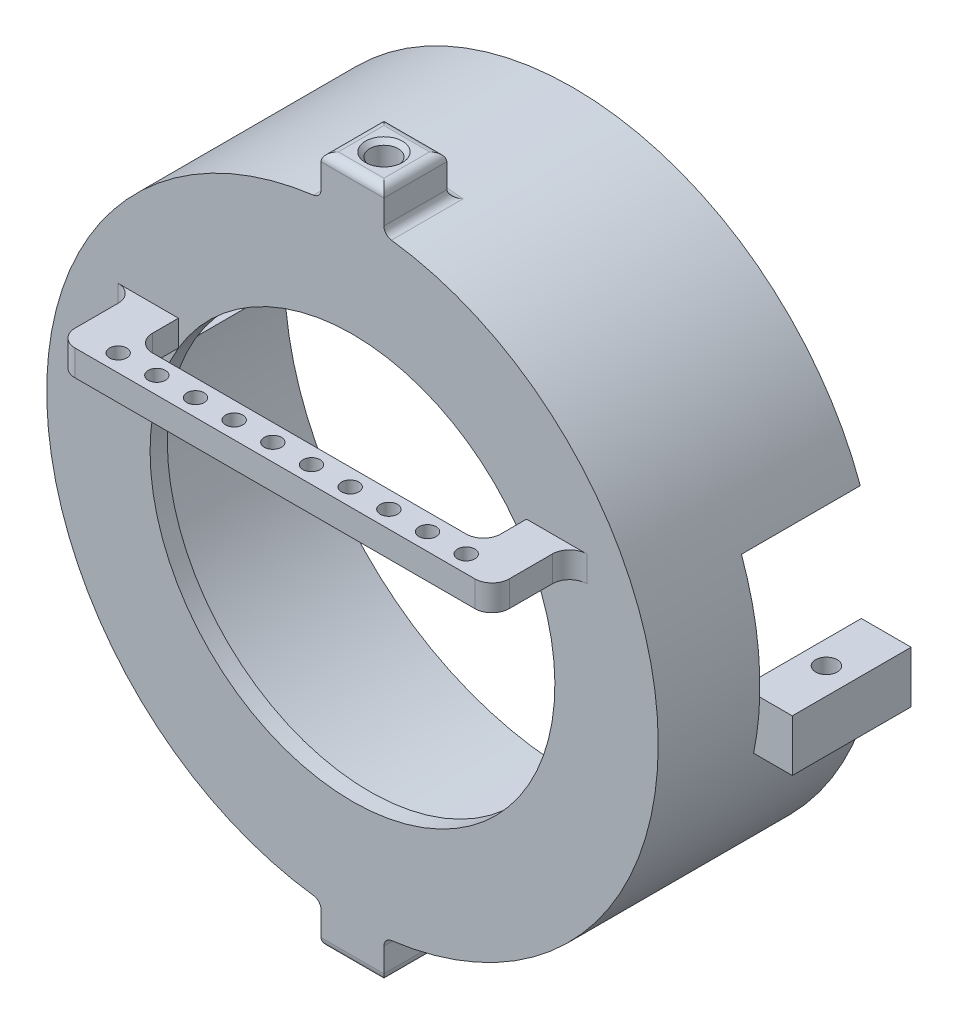
from build123d import *

# Parameters (mm, degrees)
BOSS_EXTRUDE1_REACH      = 96.735
BOSS_EXTRUDE1_END_RADIUS = 35.5
BOSS_EXTRUDE1_START      = 39.26
SKETCH6_W                = 6
SKETCH6_H                = 13.8
CUT_EXTRUDE2_DEPTH       = 58.953063767
CUT_EXTRUDE2_DEPTH_BACK  = 58.953063767
SKETCH6_3_W              = 2.3
SKETCH6_3_H              = 13.8
SKETCH11_R               = 1.25
CUT_EXTRUDE5_DEPTH       = 59.664555739
BOSS_EXTRUDE4_REACH      = 99.953
BOSS_EXTRUDE4_END_RADIUS = 35.5
BOSS_EXTRUDE4_START      = 40
SKETCH12_W               = 7.302
SKETCH12_H               = 7.302
BOSS_EXTRUDE5_REACH      = 102.814
BOSS_EXTRUDE5_END_RADIUS = 35.5
BOSS_EXTRUDE5_START      = -40
SKETCH12_5_W             = 7.302
SKETCH12_5_H             = 7.302
CUT_EXTRUDE6_DEPTH       = 61.81371227
CUT_EXTRUDE6_DEPTH_BACK  = 61.81371227
FILLET2_R                = 1
CHAMFER2_SIZE            = 0.5
SKETCH9_W                = 3
SKETCH9_H                = 13.8
CUT_REVOLVE1_ANGLE       = 20
SKETCH13_R               = 1
BOSS_EXTRUDE6_DEPTH      = 3
FILLET3_R                = 2


with BuildPart() as part:
    # Sketch3 → Revolve1 (revolve)
    with BuildSketch(Plane.YZ, mode=Mode.PRIVATE) as revolve1_sk:
        Polygon((23.5, 0), (33.5, 0), (33.5, -23.6), (35.5, -23.6), (35.5, 2), (23.5, 2), align=None)
    revolve(revolve1_sk.sketch.rotate(Axis((0, 0, 0), (0, 0, 1)), 90), axis=Axis((0, 0, 0), (0, 0, 1)))

    # Boss-Extrude1: up to this cylinder (the profile starts outside it)
    boss_extrude1_end = Plane(origin=(0, 0, -16.7), z_dir=(0, 0, -1)) * Cylinder(BOSS_EXTRUDE1_END_RADIUS, 265.47, mode=Mode.PRIVATE)
    # Sketch6 → Boss-Extrude1 (add, up to the surface)
    with BuildSketch(Plane.YZ.offset(BOSS_EXTRUDE1_START), mode=Mode.PRIVATE) as boss_extrude1_sk1:
        with Locations((-4.15, -16.7)):
            Rectangle(SKETCH6_W, SKETCH6_H)
    boss_extrude1_tool1 = extrude(boss_extrude1_sk1.sketch, amount=-BOSS_EXTRUDE1_REACH, mode=Mode.PRIVATE) - boss_extrude1_end
    boss_extrude1 = boss_extrude1_tool1.solids().sort_by_distance((39.26, -4.15, -16.7))[0]
    add(boss_extrude1)

    # Mirror1: Boss-Extrude1 across plane
    add(boss_extrude1.mirror(Plane(origin=(0, 0, 0), x_dir=(0, 0, 1), z_dir=(1, 0, 0))))

    # Sketch6<3> → Cut-Extrude2 (cut, two sides: drawn at the far end of the back side and taken through both)
    with BuildSketch(Plane.YZ.offset(-CUT_EXTRUDE2_DEPTH_BACK)):
        with Locations((0, -16.7)):
            Rectangle(SKETCH6_3_W, SKETCH6_3_H)
    extrude(amount=CUT_EXTRUDE2_DEPTH + CUT_EXTRUDE2_DEPTH_BACK, mode=Mode.SUBTRACT)

    # Sketch11 → Cut-Extrude5 (cut, through all)
    with BuildSketch(Plane(origin=(0, -1.15, 0), x_dir=(-1, 0, 0), z_dir=(0, 1, 0))):
        with Locations(Location((-36.21988, -16.8054, 0), (0, 0, 90))):
            Circle(SKETCH11_R)
    cut_extrude5 = extrude(amount=-CUT_EXTRUDE5_DEPTH, mode=Mode.SUBTRACT)

    # Boss-Extrude4: up to this cylinder (the profile starts outside it)
    boss_extrude4_end = Plane(origin=(0, 0, -1.651), z_dir=(0, 0, -1)) * Cylinder(BOSS_EXTRUDE4_END_RADIUS, 271.906, mode=Mode.PRIVATE)
    # Sketch12 → Boss-Extrude4 (add, up to the surface)
    with BuildSketch(Plane(origin=(0, 0, 0), x_dir=(-1, 0, 0), z_dir=(0, 1, 0)).offset(BOSS_EXTRUDE4_START), mode=Mode.PRIVATE) as boss_extrude4_sk1:
        with Locations((0, -1.651)):
            Rectangle(SKETCH12_W, SKETCH12_H)
    boss_extrude4_tool1 = extrude(boss_extrude4_sk1.sketch, amount=-BOSS_EXTRUDE4_REACH, mode=Mode.PRIVATE) - boss_extrude4_end
    add(boss_extrude4_tool1.solids().sort_by_distance((0, 40, -1.651))[0])

    # Boss-Extrude5: up to this cylinder (the profile starts outside it)
    boss_extrude5_end = Plane(origin=(0, 0, -1.651), z_dir=(0, 0, -1)) * Cylinder(BOSS_EXTRUDE5_END_RADIUS, 277.628, mode=Mode.PRIVATE)
    # Sketch12<5> → Boss-Extrude5 (add, up to the surface)
    with BuildSketch(Plane(origin=(0, 0, 0), x_dir=(-1, 0, 0), z_dir=(0, 1, 0)).offset(BOSS_EXTRUDE5_START), mode=Mode.PRIVATE) as boss_extrude5_sk1:
        with Locations((0, -1.651)):
            Rectangle(SKETCH12_5_W, SKETCH12_5_H)
    boss_extrude5_tool1 = extrude(boss_extrude5_sk1.sketch, amount=BOSS_EXTRUDE5_REACH, mode=Mode.PRIVATE) - boss_extrude5_end
    add(boss_extrude5_tool1.solids().sort_by_distance((0, -40, -1.651))[0])

    # Sketch12<7> → Cut-Extrude6 (cut, two sides: drawn at the far end of the back side and taken through both)
    with BuildSketch(Plane(origin=(0, 0, 0), x_dir=(-1, 0, 0), z_dir=(0, 1, 0)).offset(-CUT_EXTRUDE6_DEPTH_BACK)):
        with BuildLine():
            ThreePointArc((1.651, -1.651), (1.525325108, -1.019189653), (1.167433296, -0.483566704))
            Line((1.167433296, -0.483566704), (-1.167433296, -2.818433296))
            ThreePointArc((-1.167433296, -2.818433296), (0.631810347, -3.176325108), (1.651, -1.651))
        make_face()
        with BuildLine():
            Line((-1.167433296, -2.818433296), (1.167433296, -0.483566704))
            ThreePointArc((1.167433296, -0.483566704), (-1.167433296, -0.483566704), (-1.167433296, -2.818433296))
        make_face()
    extrude(amount=CUT_EXTRUDE6_DEPTH + CUT_EXTRUDE6_DEPTH_BACK, mode=Mode.SUBTRACT)

    # Fillet2
    fillet2_edges = [part.edges().sort_by_distance(p)[0] for p in [
        (0, 40, 2),
        (-3.651, 35.311757235, -1.651),
        (-3.651, 40, -1.651),
        (3.651, 40, -1.651),
        (0, 40, -5.302),
        (3.651, 35.311757235, -1.651),
        (0, 35.5, -5.302),
        (-3.651, -40, -1.651),
        (0, -40, 2),
        (0, -35.5, -5.302),
        (0, -40, -5.302),
        (3.651, -35.311757235, -1.651),
        (3.651, -40, -1.651),
        (-3.651, -35.311757235, -1.651),
    ]]
    fillet(fillet2_edges, radius=FILLET2_R)

    # Chamfer2
    chamfer2_edges = [part.edges().sort_by_distance(p)[0] for p in [
        (-1.167433296, -40, -0.483566704),
        (-1.167433296, 40, -0.483566704),
    ]]
    chamfer(chamfer2_edges, length=CHAMFER2_SIZE)

    # Sketch9 → Cut-Revolve1 (revolve, cut)
    with BuildSketch(Plane(origin=(0, 0, 0), x_dir=(-1, 0, 0), z_dir=(0, 1, 0))):
        with Locations((-34.980255375, -16.7)):
            Rectangle(SKETCH9_W, SKETCH9_H)
    cut_revolve1 = revolve(axis=Axis((0, 0, 0), (0, 0, 1)), revolution_arc=CUT_REVOLVE1_ANGLE, mode=Mode.SUBTRACT)

    # Mirror9: Cut-Extrude5, Cut-Revolve1 across plane
    add(cut_extrude5.mirror(Plane(origin=(0, 0, 0), x_dir=(0, 0, 1), z_dir=(1, 0, 0))), mode=Mode.SUBTRACT)
    add(cut_revolve1.mirror(Plane(origin=(0, 0, 0), x_dir=(0, 0, 1), z_dir=(1, 0, 0))), mode=Mode.SUBTRACT)

    # Sketch13 → Boss-Extrude6 (add)
    with BuildSketch(Plane(origin=(0, 12, 0), x_dir=(-1, 0, 0), z_dir=(0, 1, 0))):
        Polygon((-25.205197351, 2), (-20.205197351, 2), (-20.205197351, 7), (20.205197351, 7), (20.205197351, 2), (25.205197351, 2), (25.205197351, 11), (-25.205197351, 11), align=None)
        with Locations(Location((-20.205197351, 9, 0), (0, 0, 90))):
            Circle(SKETCH13_R, mode=Mode.SUBTRACT)
        with Locations(Location((-15.715153495, 9, 0), (0, 0, 90))):
            Circle(SKETCH13_R, mode=Mode.SUBTRACT)
        with Locations(Location((-11.22510964, 9, 0), (0, 0, 90))):
            Circle(SKETCH13_R, mode=Mode.SUBTRACT)
        with Locations(Location((-6.735065784, 9, 0), (0, 0, 90))):
            Circle(SKETCH13_R, mode=Mode.SUBTRACT)
        with Locations(Location((-2.245021928, 9, 0), (0, 0, 90))):
            Circle(SKETCH13_R, mode=Mode.SUBTRACT)
        with Locations(Location((2.245021928, 9, 0), (0, 0, 90))):
            Circle(SKETCH13_R, mode=Mode.SUBTRACT)
        with Locations(Location((6.735065784, 9, 0), (0, 0, 90))):
            Circle(SKETCH13_R, mode=Mode.SUBTRACT)
        with Locations(Location((11.22510964, 9, 0), (0, 0, 90))):
            Circle(SKETCH13_R, mode=Mode.SUBTRACT)
        with Locations(Location((15.715153495, 9, 0), (0, 0, 90))):
            Circle(SKETCH13_R, mode=Mode.SUBTRACT)
        with Locations(Location((20.205197351, 9, 0), (0, 0, 90))):
            Circle(SKETCH13_R, mode=Mode.SUBTRACT)
    extrude(amount=BOSS_EXTRUDE6_DEPTH)

    # Fillet3
    fillet3_edges = [part.edges().sort_by_distance(p)[0] for p in [
        (25.205197351, 13.5, 11),
        (25.205197351, 13.5, 2),
        (20.205197351, 13.5, 7),
        (-20.205197351, 13.5, 7),
        (-25.205197351, 13.5, 2),
        (-25.205197351, 13.5, 11),
    ]]
    fillet(fillet3_edges, radius=FILLET3_R)


solid = part.part
